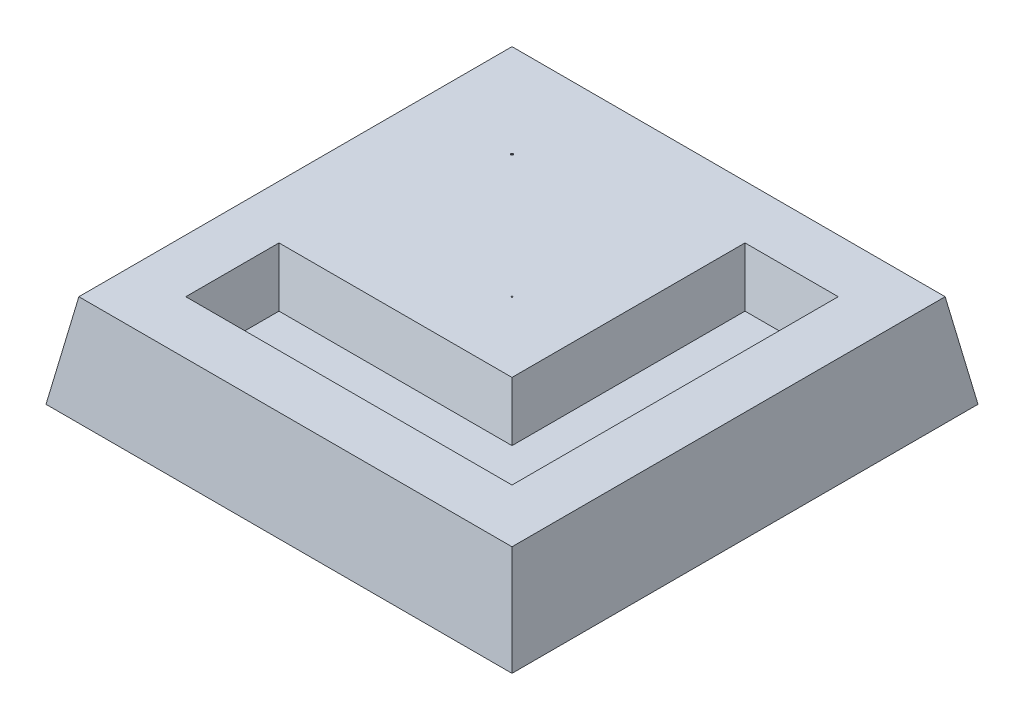
from build123d import *

# Parameters (mm, degrees)
SKETCH2_W                                    = 2540
SKETCH2_H                                    = 2540
BOSS_EXTRUDE1_DEPTH                          = 508
CUT_EXTRUDE2_DEPTH                           = 254
DRAFT3_ANGLE                                 = 15
DRAFT4_ANGLE                                 = -10
CBORE_FOR_M5_HEX_HEAD_CAP_SCREW1_D           = 5.8
CBORE_FOR_M5_HEX_HEAD_CAP_SCREW1_CBORE_D     = 12.24
CBORE_FOR_M5_HEX_HEAD_CAP_SCREW1_CBORE_DEPTH = 5.65
F_8_0MM_DOWEL_HOLE1_D                        = 8


with BuildPart() as part:
    # Sketch2 → Boss-Extrude1 (new body)
    with BuildSketch(Plane(origin=(0, 0, 0), x_dir=(1, 0, 0), z_dir=(0, 1, 0))):
        Rectangle(SKETCH2_W, SKETCH2_H)
    extrude(amount=BOSS_EXTRUDE1_DEPTH)

    # Sketch3 → Cut-Extrude2 (cut)
    with BuildSketch(Plane(origin=(0, 508, 0), x_dir=(1, 0, 0), z_dir=(0, 1, 0))):
        Polygon((381, 889), (381, -381), (-889, -381), (-889, -889), (889, -889), (889, 889), align=None)
    extrude(amount=-CUT_EXTRUDE2_DEPTH, mode=Mode.SUBTRACT)

    # Draft3
    draft3_faces = [part.faces().sort_by_distance(p)[0] for p in [
        (381, 381, -254),
        (-254, 381, 381),
        (-889, 381, 635),
        (0, 381, 889),
        (889, 381, 0),
        (635, 381, -889),
    ]]
    draft(draft3_faces, Plane.ZX.offset(508), DRAFT3_ANGLE)

    # Draft4
    draft4_faces = [part.faces().sort_by_distance(p)[0] for p in [
        (-1270, 254, 0),
        (0, 254, -1270),
        (1270, 254, 0),
        (0, 254, 1270),
    ]]
    draft(draft4_faces, Plane(origin=(0, 0, 0), x_dir=(0, 0, -1), z_dir=(0, -1, 0)), DRAFT4_ANGLE)

    # CBORE for M5 Hex Head Cap Screw1 (through all)
    with Locations(Plane(origin=(0, 508, 0), x_dir=(1, 0, 0), z_dir=(0, 1, 0))):
        with Locations((-672.4258938, 672.4258938)):
            CounterBoreHole(CBORE_FOR_M5_HEX_HEAD_CAP_SCREW1_D / 2, CBORE_FOR_M5_HEX_HEAD_CAP_SCREW1_CBORE_D / 2, CBORE_FOR_M5_HEX_HEAD_CAP_SCREW1_CBORE_DEPTH)

    # Ø8.0mm Dowel Hole1 (through all)
    with Locations(Plane(origin=(0, 508, 0), x_dir=(1, 0, 0), z_dir=(0, 1, 0))):
        with Locations((0, 0)):
            Hole(F_8_0MM_DOWEL_HOLE1_D / 2)


solid = part.part
